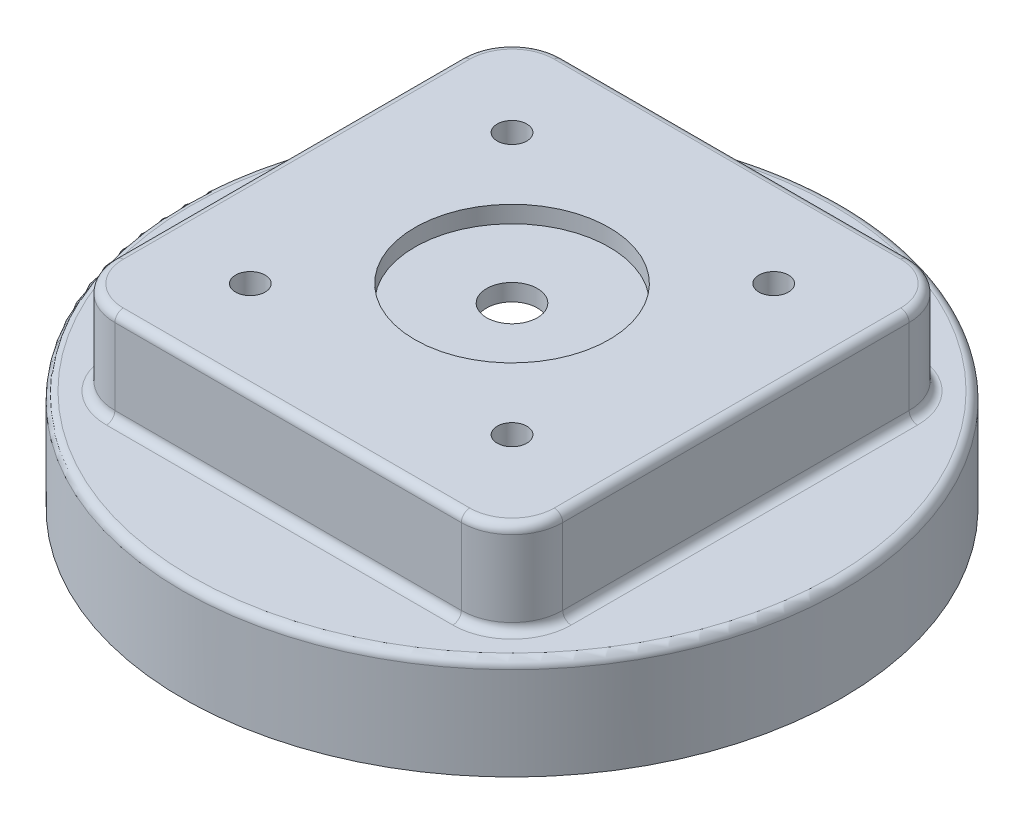
from build123d import *

# Parameters (mm, degrees)
SKETCH1_R           = 39
SKETCH1_R_2         = 35.5
BOSS_EXTRUDE1_DEPTH = 8
SKETCH2_R           = 39
BOSS_EXTRUDE2_DEPTH = 4
BOSS_EXTRUDE3_DEPTH = 7
BOSS_EXTRUDE4_DEPTH = 4
SKETCH5_R           = 11.5
CUT_EXTRUDE1_DEPTH  = 2
SKETCH6_R           = 1.75
SKETCH6_R_2         = 3
CUT_EXTRUDE2_DEPTH  = 60.757844673
FILLET1_R           = 1
FILLET2_R           = 1
SKETCH7_R           = 10.6
CUT_EXTRUDE3_DEPTH  = 50


with BuildPart() as part:
    # Sketch1 → Boss-Extrude1 (new body)
    with BuildSketch(Plane(origin=(0, 0, 0), x_dir=(1, 0, 0), z_dir=(0, 1, 0))):
        with Locations(Location((0, 0, 0), (0, 0, 270))):
            Circle(SKETCH1_R)
        with Locations(Location((0, 0, 0), (0, 0, 270))):
            Circle(SKETCH1_R_2, mode=Mode.SUBTRACT)
    extrude(amount=BOSS_EXTRUDE1_DEPTH)

    # Sketch2 → Boss-Extrude2 (add)
    with BuildSketch(Plane(origin=(0, 8, 0), x_dir=(1, 0, 0), z_dir=(0, 1, 0))):
        with Locations(Location((0, 0, 0), (0, 0, 270))):
            Circle(SKETCH2_R)
        with BuildLine():
            Line((-20.5, -22.5), (20.5, -22.5))
            ThreePointArc((20.5, -22.5), (21.914213562, -21.914213562), (22.5, -20.5))
            Line((22.5, -20.5), (22.5, 20.5))
            ThreePointArc((22.5, 20.5), (21.914213562, 21.914213562), (20.5, 22.5))
            Line((20.5, 22.5), (-20.5, 22.5))
            ThreePointArc((-20.5, 22.5), (-21.914213562, 21.914213562), (-22.5, 20.5))
            Line((-22.5, 20.5), (-22.5, -20.5))
            ThreePointArc((-22.5, -20.5), (-21.914213562, -21.914213562), (-20.5, -22.5))
        make_face(mode=Mode.SUBTRACT)
    extrude(amount=BOSS_EXTRUDE2_DEPTH)

    # Sketch3 → Boss-Extrude3 (add)
    with BuildSketch(Plane(origin=(0, 12, 0), x_dir=(1, 0, 0), z_dir=(0, 1, 0))):
        with BuildLine():
            Line((-20.5, -26.5), (20.5, -26.5))
            ThreePointArc((20.5, -26.5), (24.742640687, -24.742640687), (26.5, -20.5))
            Line((26.5, -20.5), (26.5, 20.5))
            ThreePointArc((26.5, 20.5), (24.742640687, 24.742640687), (20.5, 26.5))
            Line((20.5, 26.5), (-20.5, 26.5))
            ThreePointArc((-20.5, 26.5), (-24.742640687, 24.742640687), (-26.5, 20.5))
            Line((-26.5, 20.5), (-26.5, -20.5))
            ThreePointArc((-26.5, -20.5), (-24.742640687, -24.742640687), (-20.5, -26.5))
        make_face()
        with BuildLine():
            Line((-20.5, -22.5), (20.5, -22.5))
            ThreePointArc((20.5, -22.5), (21.914213562, -21.914213562), (22.5, -20.5))
            Line((22.5, -20.5), (22.5, 20.5))
            ThreePointArc((22.5, 20.5), (21.914213562, 21.914213562), (20.5, 22.5))
            Line((20.5, 22.5), (-20.5, 22.5))
            ThreePointArc((-20.5, 22.5), (-21.914213562, 21.914213562), (-22.5, 20.5))
            Line((-22.5, 20.5), (-22.5, -20.5))
            ThreePointArc((-22.5, -20.5), (-21.914213562, -21.914213562), (-20.5, -22.5))
        make_face(mode=Mode.SUBTRACT)
    extrude(amount=BOSS_EXTRUDE3_DEPTH)

    # Sketch4 → Boss-Extrude4 (add)
    with BuildSketch(Plane(origin=(0, 19, 0), x_dir=(1, 0, 0), z_dir=(0, 1, 0))):
        with BuildLine():
            Line((-20.5, -26.5), (20.5, -26.5))
            ThreePointArc((20.5, -26.5), (24.742640687, -24.742640687), (26.5, -20.5))
            Line((26.5, -20.5), (26.5, 20.5))
            ThreePointArc((26.5, 20.5), (24.742640687, 24.742640687), (20.5, 26.5))
            Line((20.5, 26.5), (-20.5, 26.5))
            ThreePointArc((-20.5, 26.5), (-24.742640687, 24.742640687), (-26.5, 20.5))
            Line((-26.5, 20.5), (-26.5, -20.5))
            ThreePointArc((-26.5, -20.5), (-24.742640687, -24.742640687), (-20.5, -26.5))
        make_face()
    extrude(amount=BOSS_EXTRUDE4_DEPTH)

    # Sketch5 → Cut-Extrude1 (cut)
    with BuildSketch(Plane(origin=(0, 23, 0), x_dir=(1, 0, 0), z_dir=(0, 1, 0))):
        with Locations(Location((0, 0, 0), (0, 0, 270))):
            Circle(SKETCH5_R)
    extrude(amount=-CUT_EXTRUDE1_DEPTH, mode=Mode.SUBTRACT)

    # Sketch6 → Cut-Extrude2 (cut, through all)
    with BuildSketch(Plane(origin=(0, 23, 0), x_dir=(1, 0, 0), z_dir=(0, 1, 0))):
        with Locations(Location((-15.485638508, 15.485638508, 0), (0, 0, 270))):
            Circle(SKETCH6_R)
        with Locations(Location((15.485638508, 15.485638508, 0), (0, 0, 270))):
            Circle(SKETCH6_R)
        with Locations(Location((15.485638508, -15.485638508, 0), (0, 0, 270))):
            Circle(SKETCH6_R)
        with Locations(Location((-15.485638508, -15.485638508, 0), (0, 0, 270))):
            Circle(SKETCH6_R)
        with Locations(Location((0, 0, 0), (0, 0, 270))):
            Circle(SKETCH6_R_2)
    extrude(amount=-CUT_EXTRUDE2_DEPTH, mode=Mode.SUBTRACT)

    # Fillet1
    fillet1_edges = [part.edges().sort_by_distance(p)[0] for p in [
        (-24.742640687, 12, 24.742640687),
        (0, 12, 26.5),
        (24.742640687, 12, 24.742640687),
        (26.5, 12, 0),
        (24.742640687, 12, -24.742640687),
        (0, 12, -26.5),
        (-24.742640687, 12, -24.742640687),
        (-26.5, 12, 0),
        (0, 12, -39),
    ]]
    fillet(fillet1_edges, radius=FILLET1_R)

    # Fillet2
    fillet2_edges = [part.edges().sort_by_distance(p)[0] for p in [
        (-24.742640687, 23, 24.742640687),
        (0, 23, 26.5),
        (24.742640687, 23, 24.742640687),
        (26.5, 23, 0),
        (24.742640687, 23, -24.742640687),
        (0, 23, -26.5),
        (-24.742640687, 23, -24.742640687),
        (-26.5, 23, 0),
    ]]
    fillet(fillet2_edges, radius=FILLET2_R)

    # Sketch7 → Cut-Extrude3 (cut)
    with BuildSketch(Plane(origin=(0, 0, 0), x_dir=(0, 0, -1), z_dir=(1, 0, 0))):
        with Locations((0, -2.75)):
            Circle(SKETCH7_R)
    extrude(amount=-CUT_EXTRUDE3_DEPTH, mode=Mode.SUBTRACT)


solid = part.part
